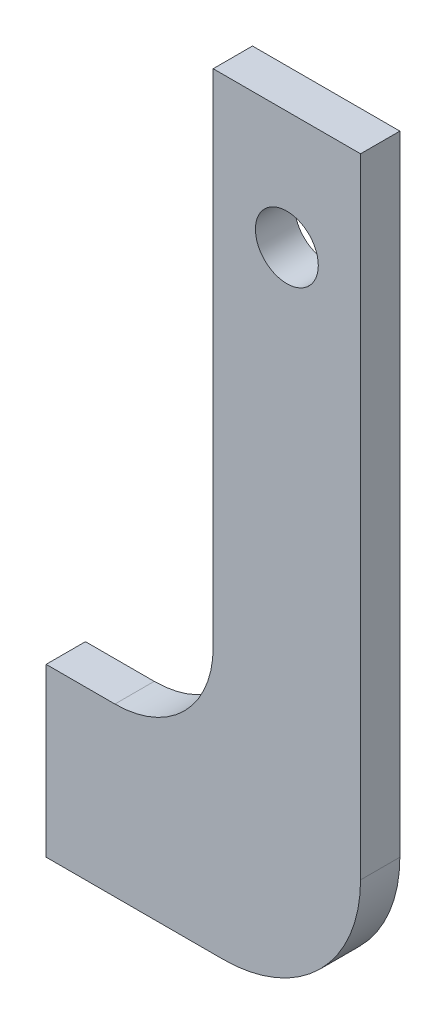
from build123d import *

# Parameters (mm, degrees)
SKETCH_1_R      = 1.6
EXTRUDE_1_DEPTH = 2


with BuildPart() as part:
    # 草图1 → 凸台-拉伸1 (new body)
    with BuildSketch(Plane.XY):
        with BuildLine():
            Line((-7.738670695, -1.280966767), (-11.238670695, -1.280966767))
            Line((-11.238670695, -1.280966767), (-11.238670695, -9.780966767))
            Line((-11.238670695, -9.780966767), (-2.738670695, -9.780966767))
            Line((-2.738670695, -9.780966767), (-2.238670695, -9.780966767))
            ThreePointArc((-2.238670695, -9.780966767), (2.711076773, -7.730714236), (4.761329305, -2.780966767))
            Line((4.761329305, -2.780966767), (4.761329305, -1.280966767))
            Line((4.761329305, -1.280966767), (4.761329305, 29.219033233))
            Line((4.761329305, 29.219033233), (-2.738670695, 29.219033233))
            Line((-2.738670695, 29.219033233), (-2.738670695, 3.719033233))
            ThreePointArc((-2.738670695, 3.719033233), (-4.203136789, 0.183499327), (-7.738670695, -1.280966767))
        make_face()
        with Locations((1.011329305, 23.219033233)):
            Circle(SKETCH_1_R, mode=Mode.SUBTRACT)
    extrude(amount=EXTRUDE_1_DEPTH)


solid = part.part
